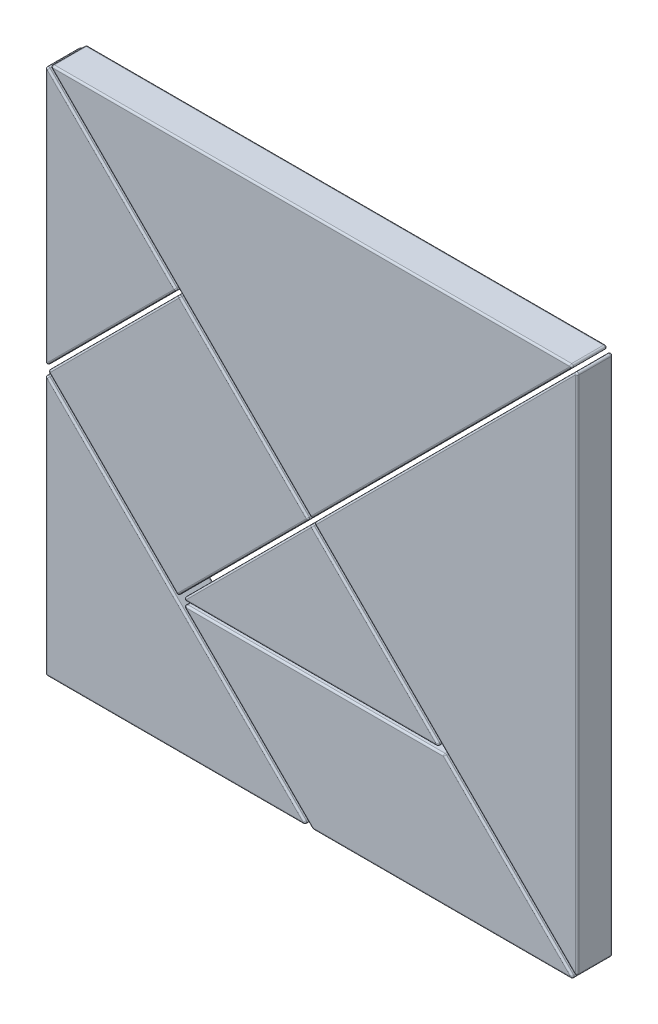
from build123d import *

# Parameters (mm, degrees)
EXTRUDE_1_DEPTH   = 10
EXTRUDE_1_2_DEPTH = 10
EXTRUDE_1_3_DEPTH = 10
EXTRUDE_1_4_DEPTH = 10
EXTRUDE_1_5_DEPTH = 10
EXTRUDE_1_6_DEPTH = 10
EXTRUDE_1_7_DEPTH = 10
FILLET_1_R        = 0.5
FILLET_2_R        = 0.5
FILLET_3_R        = 0.5
FILLET_4_R        = 0.5
FILLET_5_R        = 0.5
FILLET_6_R        = 0.5
FILLET_7_R        = 0.5
FILLET_8_R        = 0.5
FILLET_9_R        = 0.5
FILLET_10_R       = 0.5
FILLET_11_R       = 0.5
FILLET_12_R       = 0.5
FILLET_13_R       = 0.5
FILLET_14_R       = 0.5
FILLET_15_R       = 0.5
FILLET_16_R       = 0.5
FILLET_17_R       = 0.5
FILLET_18_R       = 0.5
FILLET_19_R       = 0.5
FILLET_20_R       = 0.5
FILLET_21_R       = 0.5
FILLET_22_R       = 0.5


with BuildPart() as part:
    # 草图1 → 凸台-拉伸1 (new body)
    with BuildSketch(Plane.XY):
        Polygon((0, 0), (73.939339828, 0), (0, 73.939339828), align=None)
    extrude(amount=EXTRUDE_1_DEPTH)

    # 圆角7
    fillet_7_edges = [part.edges().sort_by_distance(p)[0] for p in [
        (73.939339828, 0, 5),
        (0, 0, 5),
        (0, 73.939339828, 5),
    ]]
    fillet(fillet_7_edges, radius=FILLET_7_R)

    # 圆角15
    fillet_15_edges = [part.edges().sort_by_distance(p)[0] for p in [
        (36.969669914, 36.969669914, 10),
        (36.616116524, 0, 10),
        (0, 36.616116524, 10),
        (0.308658284, 73.194172813, 10),
        (0.146446609, 0.146446609, 10),
        (73.194172813, 0.308658284, 10),
    ]]
    fillet(fillet_15_edges, radius=FILLET_15_R)

    # 圆角16
    fillet_16_edges = [part.edges().sort_by_distance(p)[0] for p in [
        (36.969669914, 36.969669914, 0),
        (36.616116524, 0, 0),
        (0, 36.616116524, 0),
        (0.308658284, 73.194172813, 0),
        (0.146446609, 0.146446609, 0),
        (73.194172813, 0.308658284, 0),
    ]]
    fillet(fillet_16_edges, radius=FILLET_16_R)


with BuildPart() as body_2:
    # 草图1 → Extrude 1 2 (new body)
    with BuildSketch(Plane.XY):
        Polygon((0.883883476, 149.823223305), (149.116116524, 149.823223305), (75, 75.707106781), align=None)
    extrude(amount=EXTRUDE_1_2_DEPTH)

    # 圆角3
    fillet_3_edges = [body_2.edges().sort_by_distance(p)[0] for p in [
        (0.883883476, 149.823223305, 5),
        (149.116116524, 149.823223305, 5),
        (75, 75.707106781, 5),
    ]]
    fillet(fillet_3_edges, radius=FILLET_3_R)

    # 圆角11
    fillet_11_edges = [body_2.edges().sort_by_distance(p)[0] for p in [
        (111.808058262, 112.515165043, 10),
        (38.191941738, 112.515165043, 10),
        (75, 149.823223305, 10),
        (1.629050491, 149.514565021, 10),
        (148.370949509, 149.514565021, 10),
        (75, 75.914213562, 10),
    ]]
    fillet(fillet_11_edges, radius=FILLET_11_R)

    # 圆角19
    fillet_19_edges = [body_2.edges().sort_by_distance(p)[0] for p in [
        (111.808058262, 112.515165043, 0),
        (38.191941738, 112.515165043, 0),
        (75, 149.823223305, 0),
        (1.629050491, 149.514565021, 0),
        (148.370949509, 149.514565021, 0),
        (75, 75.914213562, 0),
    ]]
    fillet(fillet_19_edges, radius=FILLET_19_R)


with BuildPart() as body_3:
    # 草图1 → Extrude 1 3 (new body)
    with BuildSketch(Plane.XY):
        Polygon((150, 0.707106781), (150, 149.292893219), (75.707106781, 75), align=None)
    extrude(amount=EXTRUDE_1_3_DEPTH)

    # 圆角4
    fillet_4_edges = [body_3.edges().sort_by_distance(p)[0] for p in [
        (150, 149.292893219, 5),
        (150, 0.707106781, 5),
        (75.707106781, 75, 5),
    ]]
    fillet(fillet_4_edges, radius=FILLET_4_R)

    # 圆角10
    fillet_10_edges = [body_3.edges().sort_by_distance(p)[0] for p in [
        (150, 75, 10),
        (112.603553391, 38.103553391, 10),
        (112.603553391, 111.896446609, 10),
        (149.691341716, 148.547726204, 10),
        (75.914213562, 75, 10),
        (149.691341716, 1.452273796, 10),
    ]]
    fillet(fillet_10_edges, radius=FILLET_10_R)

    # 圆角20
    fillet_20_edges = [body_3.edges().sort_by_distance(p)[0] for p in [
        (150, 75, 0),
        (112.603553391, 111.896446609, 0),
        (112.603553391, 38.103553391, 0),
        (149.691341716, 148.547726204, 0),
        (75.914213562, 75, 0),
        (149.691341716, 1.452273796, 0),
    ]]
    fillet(fillet_20_edges, radius=FILLET_20_R)


with BuildPart() as body_4:
    # 草图1 → Extrude 1 4 (new body)
    with BuildSketch(Plane.XY):
        Polygon((0, 149.292893219), (36.969669914, 112.323223305), (0, 75.353553391), align=None)
    extrude(amount=EXTRUDE_1_4_DEPTH)

    # 圆角2
    fillet_2_edges = [body_4.edges().sort_by_distance(p)[0] for p in [
        (0, 149.292893219, 5),
        (36.969669914, 112.323223305, 5),
        (0, 75.353553391, 5),
    ]]
    fillet(fillet_2_edges, radius=FILLET_2_R)

    # 圆角14
    fillet_14_edges = [body_4.edges().sort_by_distance(p)[0] for p in [
        (18.734834957, 130.558058262, 10),
        (18.734834957, 94.088388348, 10),
        (0, 112.323223305, 10),
        (0.308658284, 148.547726204, 10),
        (0.308658284, 76.098720406, 10),
        (36.762563133, 112.323223305, 10),
    ]]
    fillet(fillet_14_edges, radius=FILLET_14_R)

    # 圆角18
    fillet_18_edges = [body_4.edges().sort_by_distance(p)[0] for p in [
        (18.734834957, 130.558058262, 0),
        (0, 112.323223305, 0),
        (18.734834957, 94.088388348, 0),
        (0.308658284, 148.547726204, 0),
        (0.308658284, 76.098720406, 0),
        (36.762563133, 112.323223305, 0),
    ]]
    fillet(fillet_18_edges, radius=FILLET_18_R)


with BuildPart() as body_5:
    # 草图1 → Extrude 1 5 (new body)
    with BuildSketch(Plane.XY):
        Polygon((38.530330086, 37.823223305), (111.469669914, 37.823223305), (75, 74.292893219), align=None)
    extrude(amount=EXTRUDE_1_5_DEPTH)

    # 圆角6
    fillet_6_edges = [body_5.edges().sort_by_distance(p)[0] for p in [
        (111.469669914, 37.823223305, 5),
        (38.530330086, 37.823223305, 5),
        (75, 74.292893219, 5),
    ]]
    fillet(fillet_6_edges, radius=FILLET_6_R)

    # 圆角12
    fillet_12_edges = [body_5.edges().sort_by_distance(p)[0] for p in [
        (92.984834957, 56.308058262, 10),
        (75, 37.823223305, 10),
        (57.015165043, 56.308058262, 10),
        (75, 74.085786438, 10),
        (39.275497101, 38.131881589, 10),
        (110.724502899, 38.131881589, 10),
    ]]
    fillet(fillet_12_edges, radius=FILLET_12_R)

    # 圆角21
    fillet_21_edges = [body_5.edges().sort_by_distance(p)[0] for p in [
        (92.984834957, 56.308058262, 0),
        (75, 37.823223305, 0),
        (57.015165043, 56.308058262, 0),
        (75, 74.085786438, 0),
        (39.275497101, 38.131881589, 0),
        (110.724502899, 38.131881589, 0),
    ]]
    fillet(fillet_21_edges, radius=FILLET_21_R)


with BuildPart() as body_6:
    # 草图1 → Extrude 1 6 (new body)
    with BuildSketch(Plane.XY):
        Polygon((75.353553391, 0), (149.292893219, 0), (112.469669914, 36.823223305), (38.530330086, 36.823223305), align=None)
    extrude(amount=EXTRUDE_1_6_DEPTH)

    # 圆角8
    fillet_8_edges = [body_6.edges().sort_by_distance(p)[0] for p in [
        (112.469669914, 36.823223305, 5),
        (149.292893219, 0, 5),
        (75.353553391, 0, 5),
        (38.530330086, 36.823223305, 5),
    ]]
    fillet(fillet_8_edges, radius=FILLET_8_R)

    # 圆角9
    fillet_9_edges = [body_6.edges().sort_by_distance(p)[0] for p in [
        (130.527728176, 18.765165043, 10),
        (111.823223305, 0, 10),
        (76, 36.823223305, 10),
        (57.295495129, 18.058058262, 10),
        (75.369318456, 0.038060234, 10),
        (39.275497101, 36.514565021, 10),
        (112.453904849, 36.785163071, 10),
        (148.547726204, 0.308658284, 10),
    ]]
    fillet(fillet_9_edges, radius=FILLET_9_R)

    # 圆角22
    fillet_22_edges = [body_6.edges().sort_by_distance(p)[0] for p in [
        (130.527728176, 18.765165043, 0),
        (76, 36.823223305, 0),
        (111.823223305, 0, 0),
        (57.295495129, 18.058058262, 0),
        (75.369318456, 0.038060234, 0),
        (39.275497101, 36.514565021, 0),
        (112.453904849, 36.785163071, 0),
        (148.547726204, 0.308658284, 0),
    ]]
    fillet(fillet_22_edges, radius=FILLET_22_R)


with BuildPart() as body_7:
    # 草图1 → Extrude 1 7 (new body)
    with BuildSketch(Plane.XY):
        Polygon((0.707106781, 74.646446609), (37.676776695, 111.616116524), (74.292893219, 75), (37.323223305, 38.030330086), align=None)
    extrude(amount=EXTRUDE_1_7_DEPTH)

    # 圆角1
    fillet_1_edges = [body_7.edges().sort_by_distance(p)[0] for p in [
        (37.676776695, 111.616116524, 5),
    ]]
    fillet(fillet_1_edges, radius=FILLET_1_R)

    # 圆角5
    fillet_5_edges = [body_7.edges().sort_by_distance(p)[0] for p in [
        (0.707106781, 74.646446609, 5),
        (74.292893219, 75, 5),
        (37.323223305, 38.030330086, 5),
    ]]
    fillet(fillet_5_edges, radius=FILLET_5_R)

    # 圆角13
    fillet_13_edges = [body_7.edges().sort_by_distance(p)[0] for p in [
        (55.984834957, 93.308058262, 10),
        (37.676776695, 111.409009742, 10),
        (55.808058262, 56.515165043, 10),
        (19.191941738, 93.131281566, 10),
        (19.015165043, 56.338388348, 10),
        (0.914213562, 74.646446609, 10),
        (37.323223305, 38.237436867, 10),
        (74.085786438, 75, 10),
    ]]
    fillet(fillet_13_edges, radius=FILLET_13_R)

    # 圆角17
    fillet_17_edges = [body_7.edges().sort_by_distance(p)[0] for p in [
        (55.984834957, 93.308058262, 0),
        (37.676776695, 111.409009742, 0),
        (19.191941738, 93.131281566, 0),
        (55.808058262, 56.515165043, 0),
        (19.015165043, 56.338388348, 0),
        (0.914213562, 74.646446609, 0),
        (37.323223305, 38.237436867, 0),
        (74.085786438, 75, 0),
    ]]
    fillet(fillet_17_edges, radius=FILLET_17_R)


solid = Compound([part.part, body_2.part, body_3.part, body_4.part, body_5.part, body_6.part, body_7.part])
